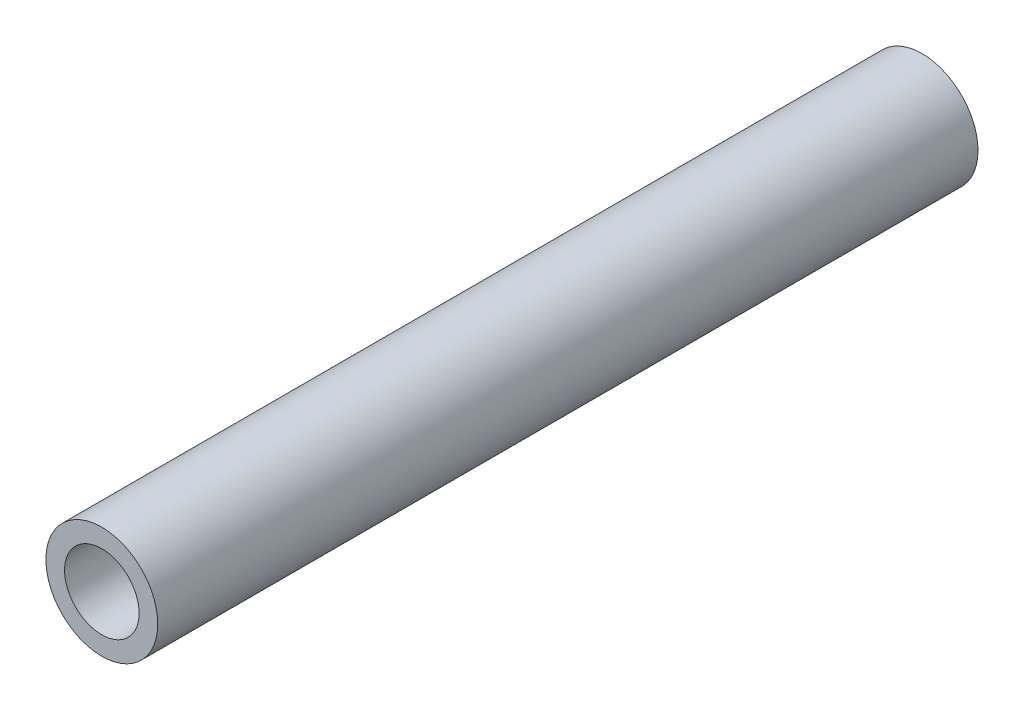
from build123d import *

# Parameters (mm, degrees)
SKETCH_1_R      = 3
SKETCH_1_R_2    = 2
EXTRUDE_1_DEPTH = 44


with BuildPart() as part:
    # 草图1 → 凸台-拉伸1 (new body)
    with BuildSketch(Plane.XY):
        Circle(SKETCH_1_R)
        Circle(SKETCH_1_R_2, mode=Mode.SUBTRACT)
    extrude(amount=EXTRUDE_1_DEPTH)


solid = part.part
